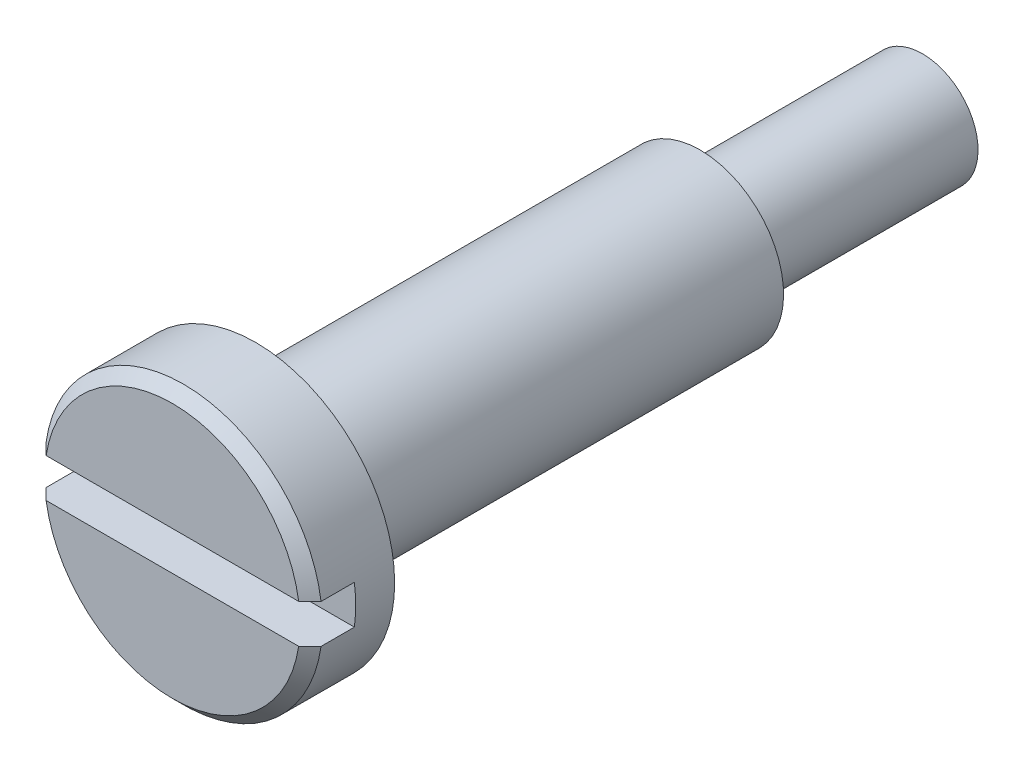
from build123d import *

# Parameters (mm, degrees)
CUT_EXTRUDE_1_DEPTH      = 14.955285737
CUT_EXTRUDE_1_DEPTH_BACK = 14.955285737
SKETCH_2_W               = 1.6
SKETCH_2_H               = 0.7
CHAMFER_1_SIZE           = 0.2


with BuildPart() as part:
    # 草图1 → 旋转1 (revolve)
    with BuildSketch(Plane(origin=(0, 0, 0), x_dir=(0, 0, -1), z_dir=(1, 0, 0))):
        Polygon((0, 0), (0, 2.5), (1.5, 2.5), (1.5, 1.5), (9.5, 1.5), (9.5, 0.7), (9.8, 0.7), (9.8, 1), (13.5, 1), (13.5, 0), align=None)
    revolve(axis=Axis((0, 0, -13.5), (0, 0, 1)))

    # 草图2 → 切除-拉伸1 (cut, two sides: drawn at the far end of the back side and taken through both)
    with BuildSketch(Plane(origin=(0, 0, 0), x_dir=(0, 0, -1), z_dir=(1, 0, 0)).offset(-CUT_EXTRUDE_1_DEPTH_BACK)):
        Rectangle(SKETCH_2_W, SKETCH_2_H)
    extrude(amount=CUT_EXTRUDE_1_DEPTH + CUT_EXTRUDE_1_DEPTH_BACK, mode=Mode.SUBTRACT)

    # 倒角1
    chamfer_1_edges = [part.edges().sort_by_distance(p)[0] for p in [
        (0, -2.5, 0),
        (-1.639359631, 1.887458609, 0),
    ]]
    chamfer(chamfer_1_edges, length=CHAMFER_1_SIZE)


solid = part.part
